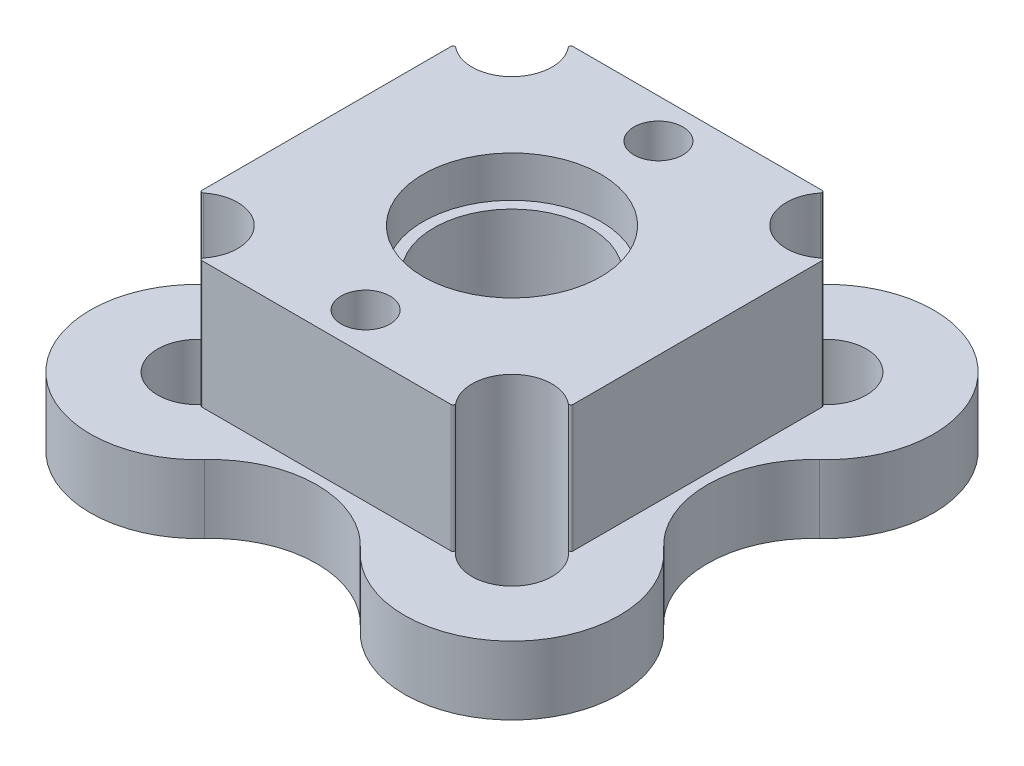
from build123d import *
from build123d.topology import SkipClean

# Parameters (mm, degrees)
SKETCH1_R               = 1.25
BOSS_EXTRUDE1_DEPTH     = 3.5
SKETCH3_R               = 2.05
CUT_EXTRUDE3_DEPTH      = 20.479604719
BOSS_EXTRUDE2_START     = 6.5
SKETCH6_R               = 1.25
BOSS_EXTRUDE2_DEPTH     = 6.5
CUT_EXTRUDE8_DEPTH      = 22.614925399
CUT_EXTRUDE7_DEPTH      = 22.614925399
CUT_EXTRUDE7_DEPTH_BACK = 22.614925399
SKETCH9_R               = 4
SKETCH11_R              = 4.55
CUT_EXTRUDE9_DEPTH      = 2.1
FILLET5_R               = 0.1


with BuildPart() as part:
    # Sketch1 → Boss-Extrude1 (new body)
    with BuildSketch(Plane(origin=(0, 0, 0), x_dir=(1, 0, 0), z_dir=(0, 1, 0))):
        with BuildLine():
            ThreePointArc((3.988860539, -11.759062722), (11.939087297, -11.939087297), (11.759062722, -3.988860539))
            ThreePointArc((11.759062722, -3.988860539), (10, 0), (11.759062722, 3.988860539))
            ThreePointArc((11.759062722, 3.988860539), (11.939087297, 11.939087297), (3.988860539, 11.759062722))
            ThreePointArc((3.988860539, 11.759062722), (0, 10), (-3.988860539, 11.759062722))
            ThreePointArc((-3.988860539, 11.759062722), (-11.939087297, 11.939087297), (-11.759062722, 3.988860539))
            ThreePointArc((-11.759062722, 3.988860539), (-10, 0), (-11.759062722, -3.988860539))
            ThreePointArc((-11.759062722, -3.988860539), (-11.939087297, -11.939087297), (-3.988860539, -11.759062722))
            ThreePointArc((-3.988860539, -11.759062722), (0, -10), (3.988860539, -11.759062722))
        make_face()
        with Locations(Location((0, -7.5, 0), (0, 0, 270))):
            Circle(SKETCH1_R, mode=Mode.SUBTRACT)
        with Locations(Location((0, 7.5, 0), (0, 0, 90))):
            Circle(SKETCH1_R, mode=Mode.SUBTRACT)
    extrude(amount=BOSS_EXTRUDE1_DEPTH)

    # Sketch3 → Cut-Extrude3 (cut, through all)
    with BuildSketch(Plane(origin=(0, 3.5, 0), x_dir=(1, 0, 0), z_dir=(0, 1, 0))):
        with Locations(Location((-8.05, 8.05, 0), (0, 0, 270))):
            Circle(SKETCH3_R)
        with Locations(Location((8.05, 8.05, 0), (0, 0, 270))):
            Circle(SKETCH3_R)
        with Locations(Location((8.05, -8.05, 0), (0, 0, 270))):
            Circle(SKETCH3_R)
        with Locations(Location((-8.05, -8.05, 0), (0, 0, 270))):
            Circle(SKETCH3_R)
    extrude(amount=-CUT_EXTRUDE3_DEPTH, mode=Mode.SUBTRACT)

    # Sketch6 → Boss-Extrude2 (add)
    with SkipClean():  # the faces are left unmerged after this step: merging them gives an invalid solid
        with BuildSketch(Plane(origin=(0, 3.5, 0), x_dir=(1, 0, 0), z_dir=(0, 1, 0)).offset(BOSS_EXTRUDE2_START)):
            with BuildLine():
                Line((6.600862325, 9.5), (-6.600862325, 9.5))
                ThreePointArc((-6.600862325, 9.5), (-6.600431099, 6.600431099), (-9.5, 6.600862325))
                Line((-9.5, 6.600862325), (-9.5, -6.600862325))
                ThreePointArc((-9.5, -6.600862325), (-6.600431099, -6.600431099), (-6.600862325, -9.5))
                Line((-6.600862325, -9.5), (6.600862325, -9.5))
                ThreePointArc((6.600862325, -9.5), (6.600431099, -6.600431099), (9.5, -6.600862325))
                Line((9.5, -6.600862325), (9.5, 6.600862325))
                ThreePointArc((9.5, 6.600862325), (6.600431099, 6.600431099), (6.600862325, 9.5))
            make_face()
            with Locations(Location((0, -7.5, 0), (0, 0, 270))):
                Circle(SKETCH6_R, mode=Mode.SUBTRACT)
            with Locations(Location((0, 7.5, 0), (0, 0, 90))):
                Circle(SKETCH6_R, mode=Mode.SUBTRACT)
        extrude(amount=-BOSS_EXTRUDE2_DEPTH)

    # Sketch10 → Cut-Extrude8 (cut, through all)
    with SkipClean():  # the faces are left unmerged after this step: merging them gives an invalid solid
        with BuildSketch(Plane(origin=(0, 10, 0), x_dir=(1, 0, 0), z_dir=(0, 1, 0))):
            with BuildLine():
                Line((-3.519943181, 1.9), (-3.519943181, -1.9))
                ThreePointArc((-3.519943181, -1.9), (0, -4), (3.519943181, -1.9))
                Line((3.519943181, -1.9), (3.519943181, 1.9))
                ThreePointArc((3.519943181, 1.9), (0, 4), (-3.519943181, 1.9))
            make_face()
        extrude(amount=-CUT_EXTRUDE8_DEPTH, mode=Mode.SUBTRACT)

    # Sketch9 → Cut-Extrude7 (cut, two sides: drawn at the far end of the back side and taken through both)
    with SkipClean():  # the faces are left unmerged after this step: merging them gives an invalid solid
        with BuildSketch(Plane(origin=(0, 10, 0), x_dir=(1, 0, 0), z_dir=(0, 1, 0)).offset(-CUT_EXTRUDE7_DEPTH_BACK)):
            with Locations(Location((0, 0, 0), (0, 0, 90))):
                Circle(SKETCH9_R)
        extrude(amount=CUT_EXTRUDE7_DEPTH + CUT_EXTRUDE7_DEPTH_BACK, mode=Mode.SUBTRACT)

    # Sketch11 → Cut-Extrude9 (cut)
    with SkipClean():  # the faces are left unmerged after this step: merging them gives an invalid solid
        with BuildSketch(Plane(origin=(0, 10, 0), x_dir=(1, 0, 0), z_dir=(0, 1, 0))):
            with Locations(Location((0, 0, 0), (0, 0, 270))):
                Circle(SKETCH11_R)
        extrude(amount=-CUT_EXTRUDE9_DEPTH, mode=Mode.SUBTRACT)

    # Fillet5
    fillet5_edges = [part.edges().sort_by_distance(p)[0] for p in [
        (9.5, 6.75, -6.600862325),
        (6.600862325, 6.75, -9.5),
        (9.5, 6.75, 6.600862325),
        (6.600862325, 6.75, 9.5),
        (-6.600862325, 6.75, 9.5),
        (-9.5, 6.75, 6.600862325),
        (-9.5, 6.75, -6.600862325),
        (-6.600862325, 6.75, -9.5),
    ]]
    fillet(fillet5_edges, radius=FILLET5_R)


solid = part.part
